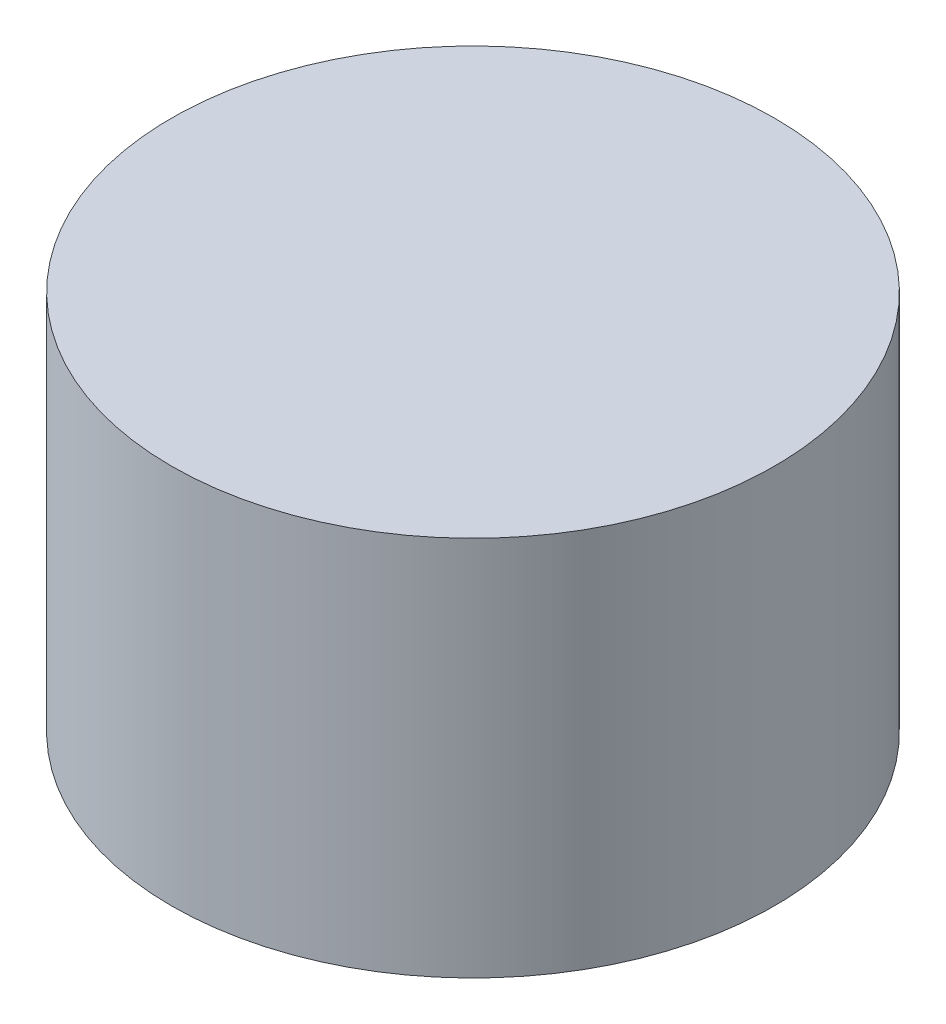
from build123d import *

# Parameters (mm, degrees)
SKETCH1_R           = 20.9
BOSS_EXTRUDE1_DEPTH = 26.4


with BuildPart() as part:
    # Sketch1 → Boss-Extrude1 (new body)
    with BuildSketch(Plane(origin=(0, 0, 0), x_dir=(1, 0, 0), z_dir=(0, 1, 0))):
        with Locations(Location((0, 0, 0), (0, 0, 270))):
            Circle(SKETCH1_R)
    extrude(amount=-BOSS_EXTRUDE1_DEPTH)


solid = part.part
